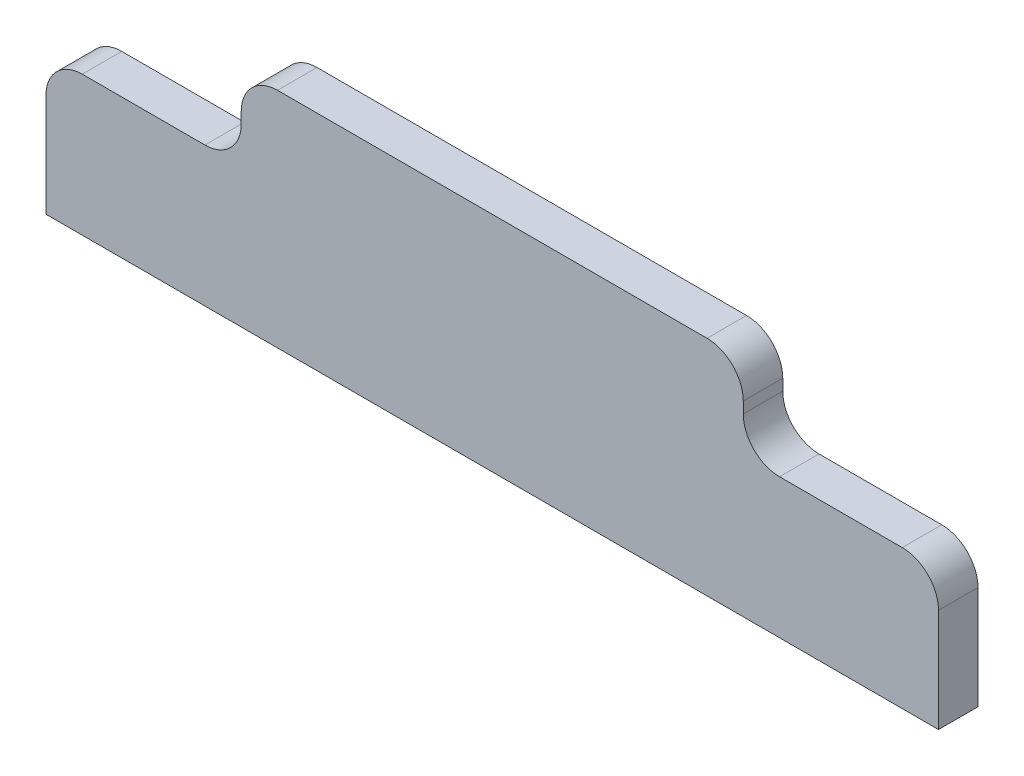
from build123d import *

# Parameters (mm, degrees)
SKETCH1_W           = 406.4
SKETCH1_H           = 101.6
BOSS_EXTRUDE1_DEPTH = 17.9832
SKETCH2_W           = 88.9
SKETCH2_H           = 38.1
CUT_EXTRUDE1_DEPTH  = 228.895141419
FILLET1_R           = 16.51


with BuildPart() as part:
    # Sketch1 → Boss-Extrude1 (new body)
    with BuildSketch(Plane.XY):
        with Locations((0, 50.8)):
            Rectangle(SKETCH1_W, SKETCH1_H)
    extrude(amount=BOSS_EXTRUDE1_DEPTH)

    # Sketch2 → Cut-Extrude1 (cut, through all)
    with BuildSketch(Plane.XY.offset(17.9832)):
        with Locations((-158.75, 82.55)):
            Rectangle(SKETCH2_W, SKETCH2_H)
        with Locations((158.75, 82.55)):
            Rectangle(SKETCH2_W, SKETCH2_H)
    extrude(amount=-CUT_EXTRUDE1_DEPTH, mode=Mode.SUBTRACT)

    # Fillet1
    fillet1_edges = [part.edges().sort_by_distance(p)[0] for p in [
        (-114.3, 63.5, 8.9916),
        (-114.3, 101.6, 8.9916),
        (-203.2, 63.5, 8.9916),
        (203.2, 63.5, 8.9916),
        (114.3, 63.5, 8.9916),
        (114.3, 101.6, 8.9916),
    ]]
    fillet(fillet1_edges, radius=FILLET1_R)


solid = part.part
